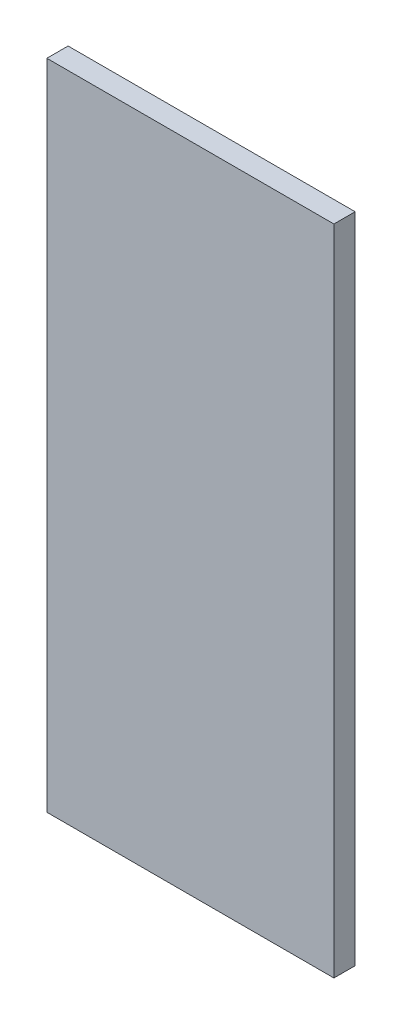
from build123d import *

# Parameters (mm, degrees)
SKETCH1_W           = 27.034600944
SKETCH1_H           = 61.50289226
BOSS_EXTRUDE1_DEPTH = 2
SKETCH2_W           = 22.434600944
SKETCH2_H           = 58.90289226
BOSS_EXTRUDE2_DEPTH = 1
SKETCH3_W           = 22.434600944
SKETCH3_H           = 0.2
BOSS_EXTRUDE3_DEPTH = 0.6


with BuildPart() as part:
    # Sketch1 → Boss-Extrude1 (new body)
    with BuildSketch(Plane.XY):
        with Locations((0, 15.582400554)):
            Rectangle(SKETCH1_W, SKETCH1_H)
    extrude(amount=BOSS_EXTRUDE1_DEPTH)


with BuildPart() as body_2:
    # Sketch2 → Boss-Extrude2 (new body)
    with BuildSketch(Plane(origin=(0, 0, 0), x_dir=(-1, 0, 0), z_dir=(0, 0, -1))):
        with Locations((0, 14.582400554)):
            Rectangle(SKETCH2_W, SKETCH2_H)
    extrude(amount=BOSS_EXTRUDE2_DEPTH)


with BuildPart() as body_3:
    # Sketch3 → Boss-Extrude3 (new body)
    with BuildSketch(Plane.XZ.offset(14.869045576)):
        with Locations((0, -1.1)):
            Rectangle(SKETCH3_W, SKETCH3_H)
        with Locations((0, -0.9)):
            Rectangle(SKETCH3_W, SKETCH3_H)
    extrude(amount=BOSS_EXTRUDE3_DEPTH)


solid = Compound([part.part, body_2.part, body_3.part])
